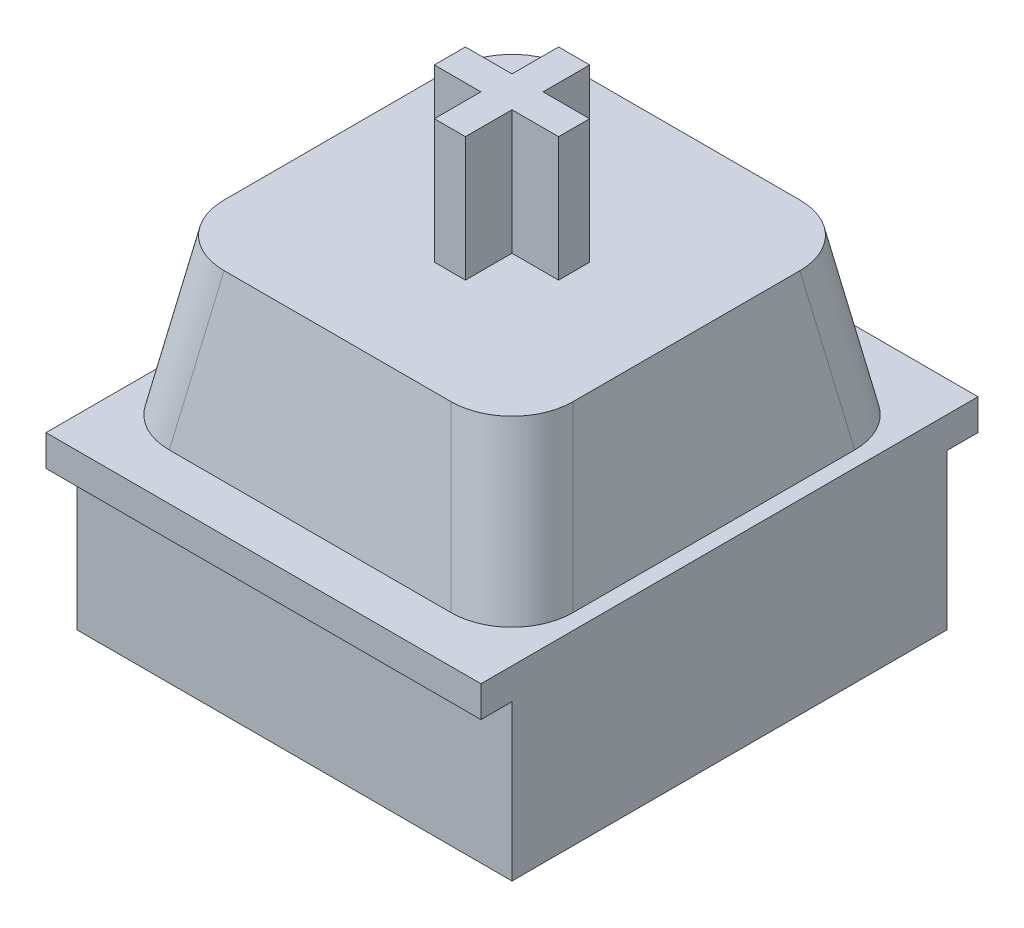
from build123d import *

# Parameters (mm, degrees)
SKETCH1_W           = 14
SKETCH1_H           = 14
BOSS_EXTRUDE1_DEPTH = 5
SKETCH2_W           = 14
SKETCH2_H           = 16
BOSS_EXTRUDE2_DEPTH = 1
SKETCH3_W           = 13
SKETCH3_H           = 13
BOSS_EXTRUDE3_DEPTH = 5
BOSS_EXTRUDE3_TAPER = 10
BOSS_EXTRUDE4_DEPTH = 4
SKETCH5_R           = 1.75
BOSS_EXTRUDE5_DEPTH = 3
SKETCH6_R           = 0.75
BOSS_EXTRUDE6_DEPTH = 3
FILLET1_R           = 2


with BuildPart() as part:
    # Sketch1 → Boss-Extrude1 (new body)
    with BuildSketch(Plane(origin=(0, 0, 0), x_dir=(1, 0, 0), z_dir=(0, 1, 0))):
        Rectangle(SKETCH1_W, SKETCH1_H)
    extrude(amount=BOSS_EXTRUDE1_DEPTH)

    # Sketch2 → Boss-Extrude2 (add)
    with BuildSketch(Plane(origin=(0, 5, 0), x_dir=(1, 0, 0), z_dir=(0, 1, 0))):
        Rectangle(SKETCH2_W, SKETCH2_H)
    extrude(amount=BOSS_EXTRUDE2_DEPTH)

    # Sketch3 → Boss-Extrude3 (add)
    with BuildSketch(Plane(origin=(0, 6, 0), x_dir=(1, 0, 0), z_dir=(0, 1, 0))):
        Rectangle(SKETCH3_W, SKETCH3_H)
    extrude(amount=BOSS_EXTRUDE3_DEPTH, taper=BOSS_EXTRUDE3_TAPER)

    # Sketch4 → Boss-Extrude4 (add)
    with BuildSketch(Plane(origin=(0, 11, 0), x_dir=(1, 0, 0), z_dir=(0, 1, 0))):
        Polygon((0.5, -0.5), (2, -0.5), (2, 0.5), (0.5, 0.5), (0.5, 2), (-0.5, 2), (-0.5, 0.5), (-2, 0.5), (-2, -0.5), (-0.5, -0.5), (-0.5, -2), (0.5, -2), align=None)
    extrude(amount=BOSS_EXTRUDE4_DEPTH)

    # Sketch5 → Boss-Extrude5 (add)
    with BuildSketch(Plane.XZ):
        with Locations(Location((0, 0, 0), (0, 0, 270))):
            Circle(SKETCH5_R)
    extrude(amount=BOSS_EXTRUDE5_DEPTH)

    # Sketch6 → Boss-Extrude6 (add)
    with BuildSketch(Plane.XZ):
        with Locations(Location((2.25, -5, 0), (0, 0, 270))):
            Circle(SKETCH6_R)
        with Locations(Location((-3.5, -2.75, 0), (0, 0, 270))):
            Circle(SKETCH6_R)
    extrude(amount=BOSS_EXTRUDE6_DEPTH)

    # Fillet1
    fillet1_edges = [part.edges().sort_by_distance(p)[0] for p in [
        (6.059182548, 8.5, 6.059182548),
        (6.059182548, 8.5, -6.059182548),
        (-6.059182548, 8.5, -6.059182548),
        (-6.059182548, 8.5, 6.059182548),
    ]]
    fillet(fillet1_edges, radius=FILLET1_R)


solid = part.part
